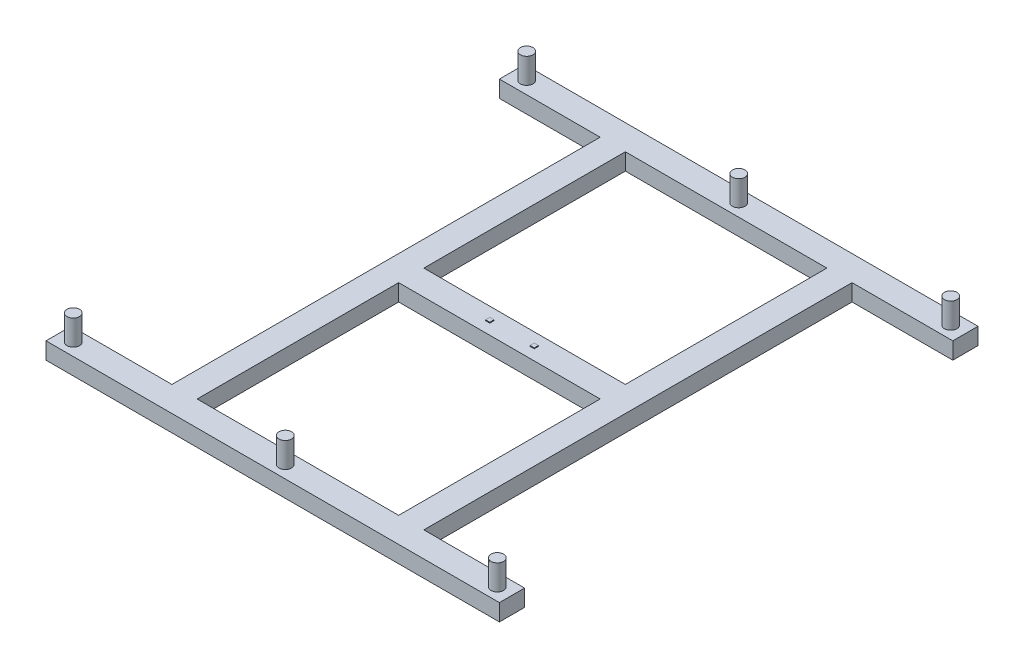
from build123d import *

# Parameters (mm, degrees)
SKETCH1_W           = 240
SKETCH1_H           = 240
BOSS_EXTRUDE1_DEPTH = 20
SKETCH1_3_W         = 120
SKETCH1_3_H         = 30
BOSS_EXTRUDE2_DEPTH = 20
SKETCH2_R           = 7.5
BOSS_EXTRUDE3_DEPTH = 30
SKETCH4_W           = 5
SKETCH4_H           = 5
BOSS_EXTRUDE4_DEPTH = 1


with BuildPart() as part:
    # Sketch1 → Boss-Extrude1 (new body)
    with BuildSketch(Plane(origin=(0, 0, 0), x_dir=(1, 0, 0), z_dir=(0, 1, 0))):
        Polygon((150, 285), (-150, 285), (-150, 255), (-150, -255), (-150, -285), (150, -285), (150, -255), (150, 255), align=None)
        with Locations((0, -135)):
            Rectangle(SKETCH1_W, SKETCH1_H, mode=Mode.SUBTRACT)
        with Locations((0, 135)):
            Rectangle(SKETCH1_W, SKETCH1_H, mode=Mode.SUBTRACT)
    extrude(amount=BOSS_EXTRUDE1_DEPTH)

    # Sketch1<3> → Boss-Extrude2 (add)
    with BuildSketch(Plane(origin=(0, 0, 0), x_dir=(1, 0, 0), z_dir=(0, 1, 0))):
        with Locations((-210, 270)):
            Rectangle(SKETCH1_3_W, SKETCH1_3_H)
        with Locations((210, 270)):
            Rectangle(SKETCH1_3_W, SKETCH1_3_H)
        with Locations((-210, -270)):
            Rectangle(SKETCH1_3_W, SKETCH1_3_H)
        with Locations((210, -270)):
            Rectangle(SKETCH1_3_W, SKETCH1_3_H)
    extrude(amount=BOSS_EXTRUDE2_DEPTH)

    # Sketch2 → Boss-Extrude3 (add)
    with BuildSketch(Plane(origin=(0, 20, 0), x_dir=(1, 0, 0), z_dir=(0, 1, 0))):
        with Locations((0, 270)):
            Circle(SKETCH2_R)
        with Locations((252.5, 270)):
            Circle(SKETCH2_R)
        with Locations((-252.5, 270)):
            Circle(SKETCH2_R)
        with Locations((-252.5, -270)):
            Circle(SKETCH2_R)
        with Locations((252.5, -270)):
            Circle(SKETCH2_R)
        with Locations((0, -270)):
            Circle(SKETCH2_R)
    extrude(amount=BOSS_EXTRUDE3_DEPTH)

    # Sketch4 → Boss-Extrude4 (add)
    with BuildSketch(Plane(origin=(0, 20, 0), x_dir=(1, 0, 0), z_dir=(0, 1, 0))):
        with Locations((-26.5, 0)):
            Rectangle(SKETCH4_W, SKETCH4_H)
        with Locations((26.5, 0)):
            Rectangle(SKETCH4_W, SKETCH4_H)
    extrude(amount=BOSS_EXTRUDE4_DEPTH)


solid = part.part
